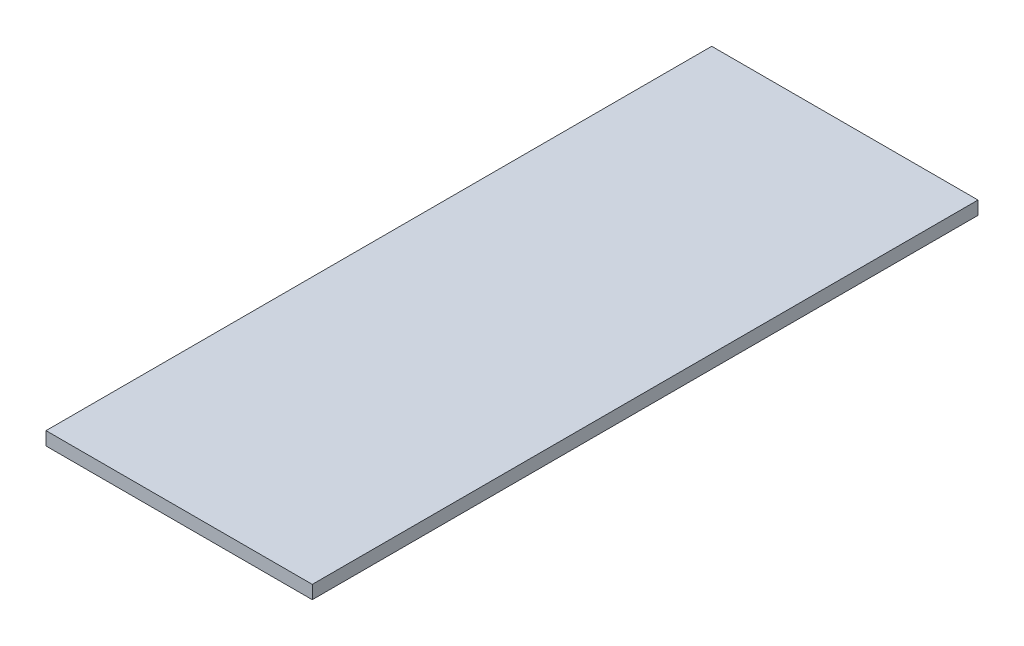
from build123d import *

# Parameters (mm, degrees)
SKETCH1_W                            = 120
SKETCH1_H                            = 300
SHELF_BLANK_NO_MOUNTING_DESIGN_DEPTH = 6


with BuildPart() as part:
    # Sketch1 → Shelf_blank_no_mounting_design (new body)
    with BuildSketch(Plane(origin=(0, 0, 0), x_dir=(1, 0, 0), z_dir=(0, 1, 0))):
        Rectangle(SKETCH1_W, SKETCH1_H)
    extrude(amount=SHELF_BLANK_NO_MOUNTING_DESIGN_DEPTH)


solid = part.part
